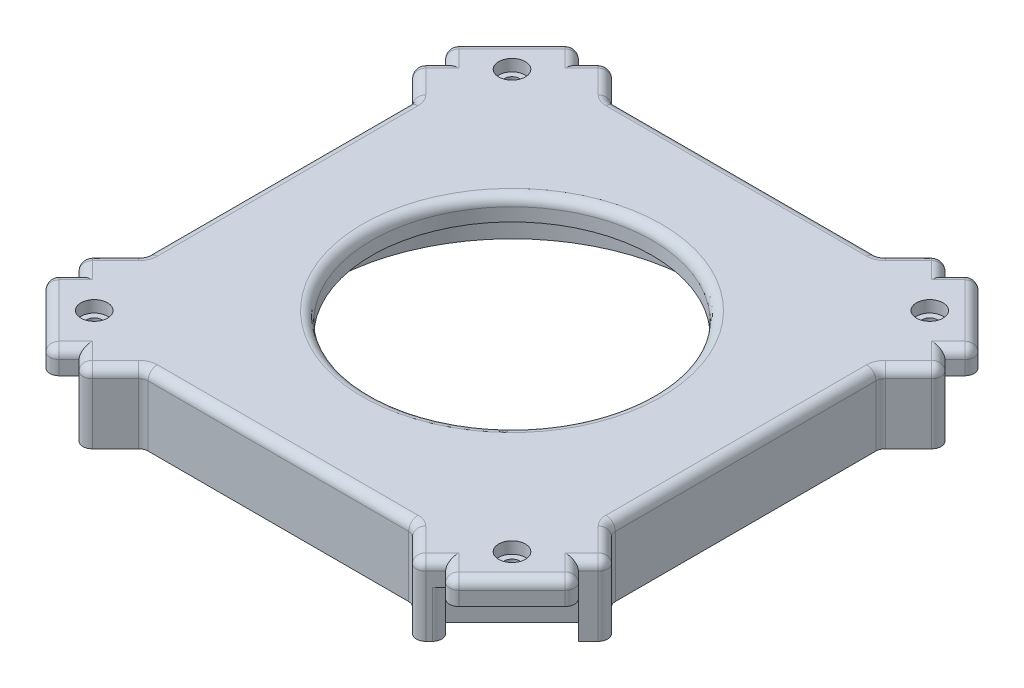
from build123d import *

# Parameters (mm, degrees)
SKETCH1_W                      = 100
SKETCH1_H                      = 100
BOSS_EXTRUDE1_DEPTH            = 15
SKETCH2_R                      = 40
CUT_EXTRUDE1_DEPTH             = 10.2
CUT_EXTRUDE2_REACH             = 73.443
SKETCH3_R                      = 30
CUT_EXTRUDE3_REACH             = 74.284
SKETCH4_W                      = 10.2
SKETCH4_H                      = 15
CUT_EXTRUDE3_DIRECTION_2_REACH = 74.284
CIRPATTERN1_COUNT              = 4
BOSS_EXTRUDE2_DEPTH            = 15
SKETCH6_W                      = 20.1
SKETCH6_H                      = 5
BOSS_EXTRUDE3_DEPTH            = 10
CIRPATTERN2_COUNT              = 4
CUT_EXTRUDE4_REACH             = 83.945
SKETCH7_R                      = 1.6
SKETCH8_R                      = 2.85
CUT_EXTRUDE5_DEPTH             = 2.5
CIRPATTERN3_COUNT              = 4
FILLET1_R                      = 2


with BuildPart() as part:
    # Sketch1 → Boss-Extrude1 (new body)
    with BuildSketch(Plane(origin=(0, 0, 0), x_dir=(1, 0, 0), z_dir=(0, 1, 0))):
        Rectangle(SKETCH1_W, SKETCH1_H)
    extrude(amount=BOSS_EXTRUDE1_DEPTH)

    # Sketch2 → Cut-Extrude1 (cut)
    with BuildSketch(Plane.XZ):
        with Locations(Location((0, 0, 0), (0, 0, 270))):
            Circle(SKETCH2_R)
    extrude(amount=-CUT_EXTRUDE1_DEPTH, mode=Mode.SUBTRACT)

    # Sketch3 → Cut-Extrude2 (cut, up to next)
    with BuildSketch(Plane.XZ.offset(-10.2), mode=Mode.PRIVATE) as cut_extrude2_sk1:
        with Locations(Location((0, 0, 0), (0, 0, 270))):
            Circle(SKETCH3_R)
    cut_extrude2_tool1 = extrude(cut_extrude2_sk1.sketch, amount=-CUT_EXTRUDE2_REACH, mode=Mode.PRIVATE) & part.part
    add(cut_extrude2_tool1.solids().sort_by_distance((0, 10.2, 0))[0], mode=Mode.SUBTRACT)

    # Sketch4 → Cut-Extrude3 (cut, up to next)
    with BuildSketch(Plane(origin=(0, 0, 0), x_dir=(-0.7071067811865475, 0, -0.7071067811865477), z_dir=(0.7071067811865477, 0, -0.7071067811865475)), mode=Mode.PRIVATE) as cut_extrude3_sk1:
        with Locations((-65.610678119, 7.5)):
            Rectangle(SKETCH4_W, SKETCH4_H)
    cut_extrude3_tool1 = extrude(cut_extrude3_sk1.sketch, amount=-CUT_EXTRUDE3_REACH, mode=Mode.PRIVATE) & part.part
    cut_extrude3 = cut_extrude3_tool1.solids().sort_by_distance((46.393755, 7.5, 46.393755))[0]
    add(cut_extrude3, mode=Mode.SUBTRACT)

    # Sketch4 → Cut-Extrude3 direction 2 (cut, up to next)
    with BuildSketch(Plane(origin=(0, 0, 0), x_dir=(-0.7071067811865475, 0, -0.7071067811865477), z_dir=(0.7071067811865477, 0, -0.7071067811865475)), mode=Mode.PRIVATE) as cut_extrude3_direction_2_sk1:
        with Locations((-65.610678119, 7.5)):
            Rectangle(SKETCH4_W, SKETCH4_H)
    cut_extrude3_direction_2_tool1 = extrude(cut_extrude3_direction_2_sk1.sketch, amount=CUT_EXTRUDE3_DIRECTION_2_REACH, mode=Mode.PRIVATE) & part.part
    cut_extrude3_direction_2 = cut_extrude3_direction_2_tool1.solids().sort_by_distance((46.393755, 7.5, 46.393755))[0]
    add(cut_extrude3_direction_2, mode=Mode.SUBTRACT)

    # CirPattern1: Cut-Extrude3, Cut-Extrude3 direction 2 ×4 about axis
    cirpattern1_axis = Axis((0, 0, 0), (0, 1, 0))
    add([cut_extrude3.rotate(cirpattern1_axis, i * 360 / CIRPATTERN1_COUNT) for i in range(1, CIRPATTERN1_COUNT)], mode=Mode.SUBTRACT)
    add([cut_extrude3_direction_2.rotate(cirpattern1_axis, i * 360 / CIRPATTERN1_COUNT) for i in range(1, CIRPATTERN1_COUNT)], mode=Mode.SUBTRACT)

    # Sketch5 → Boss-Extrude2 (add)
    with BuildSketch(Plane(origin=(0, 15, 0), x_dir=(1, 0, 0), z_dir=(0, 1, 0))):
        Polygon((-49.893933983, 35.681087681), (-53.429467889, 39.216621587), (-56.965001795, 35.681087681), (-50, 28.716085886), (-50, 35.575021664), align=None)
        Polygon((-39.216621587, 53.429467889), (-35.681087681, 56.965001795), (-28.716085886, 50), (-35.681087681, 49.893933983), align=None)
        Polygon((35.681087681, 49.893933983), (39.216621587, 53.429467889), (35.681087681, 56.965001795), (28.716085886, 50), align=None)
        Polygon((49.893933983, 35.681087681), (53.429467889, 39.216621587), (56.965001795, 35.681087681), (50, 28.716085886), align=None)
        Polygon((49.893933983, -35.681087681), (53.429467889, -39.216621587), (56.965001795, -35.681087681), (50, -28.716085886), align=None)
        Polygon((35.681087681, -49.893933983), (39.216621587, -53.429467889), (35.681087681, -56.965001795), (28.716085886, -50), align=None)
        Polygon((-35.681087681, -49.893933983), (-39.216621587, -53.429467889), (-35.681087681, -56.965001795), (-28.716085886, -50), align=None)
        Polygon((-49.893933983, -35.681087681), (-53.429467889, -39.216621587), (-56.965001795, -35.681087681), (-50, -28.716085886), align=None)
    extrude(amount=-BOSS_EXTRUDE2_DEPTH)

    # Sketch6 → Boss-Extrude3 (add)
    with BuildSketch(Plane(origin=(42.787510832, 0, 42.787510832), x_dir=(0.7071067811865476, 0, -0.7071067811865475), z_dir=(0.7071067811865475, 0, 0.7071067811865476))):
        with Locations((0, 12.5)):
            Rectangle(SKETCH6_W, SKETCH6_H)
    boss_extrude3 = extrude(amount=BOSS_EXTRUDE3_DEPTH)

    # CirPattern2: Boss-Extrude3 ×4 about axis
    cirpattern2_axis = Axis((0, 0, 0), (0, 1, 0))
    for i in range(1, CIRPATTERN2_COUNT):
        add(boss_extrude3.rotate(cirpattern2_axis, i * 360 / CIRPATTERN2_COUNT))

    # Sketch7 → Cut-Extrude4 (cut, up to next)
    with BuildSketch(Plane(origin=(0, 15, 0), x_dir=(1, 0, 0), z_dir=(0, 1, 0)), mode=Mode.PRIVATE) as cut_extrude4_sk1:
        with Locations(Location((44.696699141, 44.696699141, 0), (0, 0, 270))):
            Circle(SKETCH7_R)
    cut_extrude4_tool1 = extrude(cut_extrude4_sk1.sketch, amount=-CUT_EXTRUDE4_REACH, mode=Mode.PRIVATE) & part.part
    cut_extrude4 = cut_extrude4_tool1.solids().sort_by_distance((44.696699, 15, -44.696699))[0]
    add(cut_extrude4, mode=Mode.SUBTRACT)

    # Sketch8 → Cut-Extrude5 (cut)
    with BuildSketch(Plane(origin=(0, 15, 0), x_dir=(1, 0, 0), z_dir=(0, 1, 0))):
        with Locations(Location((44.696699141, 44.696699141, 0), (0, 0, 270))):
            Circle(SKETCH8_R)
    cut_extrude5 = extrude(amount=-CUT_EXTRUDE5_DEPTH, mode=Mode.SUBTRACT)

    # CirPattern3: Cut-Extrude4, Cut-Extrude5 ×4 about axis
    cirpattern3_axis = Axis((0, 0, 0), (0, 1, 0))
    add([cut_extrude4.rotate(cirpattern3_axis, i * 360 / CIRPATTERN3_COUNT) for i in range(1, CIRPATTERN3_COUNT)], mode=Mode.SUBTRACT)
    add([cut_extrude5.rotate(cirpattern3_axis, i * 360 / CIRPATTERN3_COUNT) for i in range(1, CIRPATTERN3_COUNT)], mode=Mode.SUBTRACT)

    # Fillet1
    fillet1_edges = [part.edges().sort_by_distance(p)[0] for p in [
        (32.198586784, 15, -53.482500897),
        (37.448854634, 15, -55.197234842),
        (35.681087681, 7.5, -56.965001795),
        (28.716085886, 7.5, -50),
        (53.482500897, 15, -32.198586784),
        (55.197234842, 15, -37.448854634),
        (50, 7.5, -28.716085886),
        (56.965001795, 7.5, -35.681087681),
        (55.197234842, 15, 37.448854634),
        (53.482500897, 15, 32.198586784),
        (56.965001795, 7.5, 35.681087681),
        (50, 7.5, 28.716085886),
        (32.198586784, 15, 53.482500897),
        (37.448854634, 15, 55.197234842),
        (28.716085886, 7.5, 50),
        (35.681087681, 7.5, 56.965001795),
        (39.216621587, 5, 53.429467889),
        (-37.448854634, 15, 55.197234842),
        (-32.198586784, 15, 53.482500897),
        (-35.681087681, 7.5, 56.965001795),
        (-28.716085886, 7.5, 50),
        (-53.482500897, 15, 32.198586784),
        (-55.197234842, 15, 37.448854634),
        (-50, 7.5, 28.716085886),
        (-56.965001795, 7.5, 35.681087681),
        (-55.197234842, 15, -37.448854634),
        (-53.482500897, 15, -32.198586784),
        (-50, 7.5, -28.716085886),
        (-56.965001795, 7.5, -35.681087681),
        (40.98438854, 15, 55.197234842),
        (55.197234842, 15, 40.98438854),
        (42.752155493, 12.5, 56.965001795),
        (56.965001795, 12.5, 42.752155493),
        (49.858578644, 15, 49.858578644),
        (55.197234842, 15, -40.98438854),
        (40.98438854, 15, -55.197234842),
        (56.965001795, 12.5, -42.752155493),
        (42.752155493, 12.5, -56.965001795),
        (49.858578644, 15, -49.858578644),
        (-40.98438854, 15, -55.197234842),
        (-55.197234842, 15, -40.98438854),
        (-42.752155493, 12.5, -56.965001795),
        (-56.965001795, 12.5, -42.752155493),
        (-49.858578644, 15, -49.858578644),
        (0, 15, 30),
        (-55.197234842, 15, 40.98438854),
        (-40.98438854, 15, 55.197234842),
        (-56.965001795, 12.5, 42.752155493),
        (-42.752155493, 12.5, 56.965001795),
        (-49.858578644, 15, 49.858578644),
        (0, 15, -50),
        (-50, 15, 0),
        (0, 15, 50),
        (50, 15, 0),
        (-32.198586784, 15, -53.482500897),
        (-37.448854634, 15, -55.197234842),
        (-28.716085886, 7.5, -50),
        (-35.681087681, 7.5, -56.965001795),
    ]]
    fillet(fillet1_edges, radius=FILLET1_R)


solid = part.part
